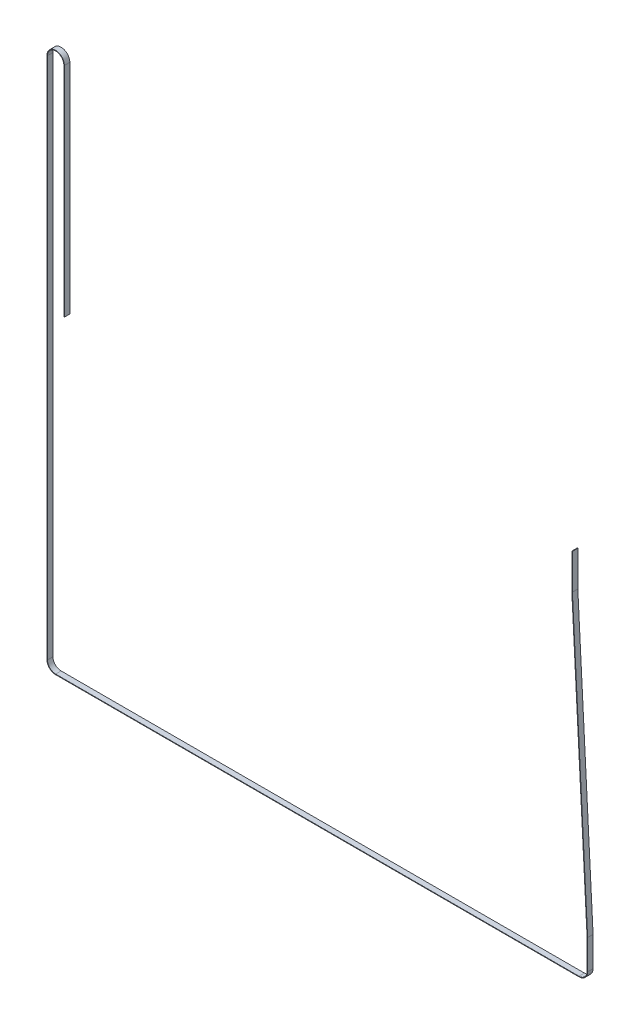
from build123d import *

# Parameters (mm, degrees)
LINEAR_AUSTRAGEN_D_NN1_DEPTH = 2.5


with BuildPart() as part:
    # Skizze1 → Linear-Austragen-Dünn1 (new, symmetric)
    with BuildSketch(Plane.XY):
        with BuildLine():
            Line((233.5, 326.961421282), (233.5, 294.5770817))
            Line((233.5, 294.5770817), (247.5, 27.187011832))
            Line((247.5, 27.187011832), (247.5, 0))
            ThreePointArc((247.5, 0), (245.303300859, -5.303300859), (240, -7.5))
            Line((240, -7.5), (-240, -7.5))
            ThreePointArc((-240, -7.5), (-245.303300859, -5.303300859), (-247.5, 0))
            Line((-247.5, 0), (-247.5, 480))
            ThreePointArc((-247.5, 480), (-240, 487.5), (-232.5, 480))
            Line((-232.5, 480), (-232.5, 280))
            Line((-232.5, 280), (-232, 280))
            Line((-232, 280), (-232, 480))
            ThreePointArc((-232, 480), (-240, 488), (-248, 480))
            Line((-248, 480), (-248, 0))
            ThreePointArc((-248, 0), (-245.656854249, -5.656854249), (-240, -8))
            Line((-240, -8), (240, -8))
            ThreePointArc((240, -8), (245.656854249, -5.656854249), (248, 0))
            Line((248, 0), (248, 27.200092364))
            Line((248, 27.200092364), (234, 294.590162233))
            Line((234, 294.590162233), (234, 326.961421282))
            Line((234, 326.961421282), (233.5, 326.961421282))
        make_face()
    extrude(amount=LINEAR_AUSTRAGEN_D_NN1_DEPTH, both=True)


solid = part.part
